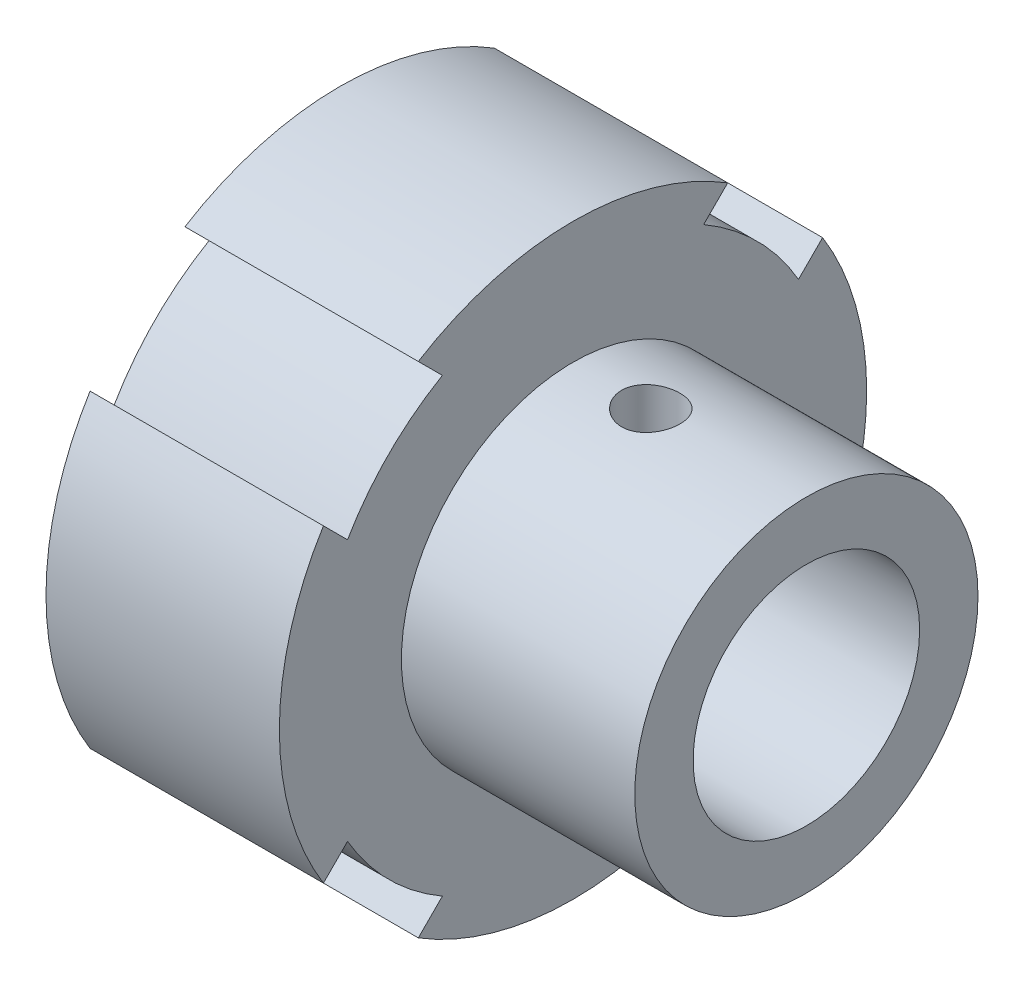
from build123d import *

# Parameters (mm, degrees)
BOSS_EXTRUDE2_DEPTH     = 10
BOSS_EXTRUDE3_DEPTH     = 2
SKETCH3_R               = 5.825
CUT_EXTRUDE1_DEPTH      = 2
BOSS_EXTRUDE4_START     = 12
SKETCH4_R               = 8.825
SKETCH4_R_2             = 5.825
BOSS_EXTRUDE4_DEPTH     = 12
CUT_EXTRUDE2_DEPTH      = 33.125068093
CUT_EXTRUDE2_DEPTH_BACK = 33.125068093
SKETCH5_R               = 1.5
CHAMFER1_SIZE           = 1


with BuildPart() as part:
    # Sketch1 → Boss-Extrude2 (new body)
    with BuildSketch(Plane(origin=(0, 0, 0), x_dir=(0, 0, -1), z_dir=(1, 0, 0))):
        with BuildLine():
            Line((-11.595322565, 6.716285775), (-12.834408967, 7.955372177))
            ThreePointArc((-12.834408967, 7.955372177), (-15.1, 0), (-12.834408967, -7.955372177))
            Line((-12.834408967, -7.955372177), (-11.595322565, -6.716285775))
            ThreePointArc((-11.595322565, -6.716285775), (-9.475230868, -9.475230868), (-6.716285775, -11.595322565))
            Line((-6.716285775, -11.595322565), (-7.955372177, -12.834408967))
            ThreePointArc((-7.955372177, -12.834408967), (0, -15.1), (7.955372177, -12.834408967))
            Line((7.955372177, -12.834408967), (6.716285775, -11.595322565))
            ThreePointArc((6.716285775, -11.595322565), (9.475230868, -9.475230868), (11.595322565, -6.716285775))
            Line((11.595322565, -6.716285775), (12.834408967, -7.955372177))
            ThreePointArc((12.834408967, -7.955372177), (14.522561334, -4.135844811), (15.1, 0))
            ThreePointArc((15.1, 0), (14.522561334, 4.135844811), (12.834408967, 7.955372177))
            Line((12.834408967, 7.955372177), (11.595322565, 6.716285775))
            ThreePointArc((11.595322565, 6.716285775), (9.475230868, 9.475230868), (6.716285775, 11.595322565))
            Line((6.716285775, 11.595322565), (7.955372177, 12.834408967))
            ThreePointArc((7.955372177, 12.834408967), (0, 15.1), (-7.955372177, 12.834408967))
            Line((-7.955372177, 12.834408967), (-6.716285775, 11.595322565))
            ThreePointArc((-6.716285775, 11.595322565), (-9.475230868, 9.475230868), (-11.595322565, 6.716285775))
        make_face()
        with BuildLine():
            Line((-11.330679795, 5.037429442), (-12.607267332, 6.31401698))
            ThreePointArc((-12.607267332, 6.31401698), (-14.1, 0), (-12.607267332, -6.31401698))
            Line((-12.607267332, -6.31401698), (-11.330679795, -5.037429442))
            ThreePointArc((-11.330679795, -5.037429442), (-8.768124087, -8.768124087), (-5.037429442, -11.330679795))
            Line((-5.037429442, -11.330679795), (-6.31401698, -12.607267332))
            ThreePointArc((-6.31401698, -12.607267332), (0, -14.1), (6.31401698, -12.607267332))
            Line((6.31401698, -12.607267332), (5.037429442, -11.330679795))
            ThreePointArc((5.037429442, -11.330679795), (8.768124087, -8.768124087), (11.330679795, -5.037429442))
            Line((11.330679795, -5.037429442), (12.607267332, -6.31401698))
            ThreePointArc((12.607267332, -6.31401698), (13.721743136, -3.244035343), (14.1, 0))
            ThreePointArc((14.1, 0), (13.721743136, 3.244035343), (12.607267332, 6.31401698))
            Line((12.607267332, 6.31401698), (11.330679795, 5.037429442))
            ThreePointArc((11.330679795, 5.037429442), (8.768124087, 8.768124087), (5.037429442, 11.330679795))
            Line((5.037429442, 11.330679795), (6.31401698, 12.607267332))
            ThreePointArc((6.31401698, 12.607267332), (0, 14.1), (-6.31401698, 12.607267332))
            Line((-6.31401698, 12.607267332), (-5.037429442, 11.330679795))
            ThreePointArc((-5.037429442, 11.330679795), (-8.768124087, 8.768124087), (-11.330679795, 5.037429442))
        make_face(mode=Mode.SUBTRACT)
    extrude(amount=BOSS_EXTRUDE2_DEPTH)

    # Sketch2 → Boss-Extrude3 (add)
    with BuildSketch(Plane(origin=(10, 0, 0), x_dir=(0, 0, -1), z_dir=(1, 0, 0))):
        with BuildLine():
            Line((-12.834408967, -7.955372177), (-11.595322565, -6.716285775))
            ThreePointArc((-11.595322565, -6.716285775), (-9.475230868, -9.475230868), (-6.716285775, -11.595322565))
            Line((-6.716285775, -11.595322565), (-7.955372177, -12.834408967))
            ThreePointArc((-7.955372177, -12.834408967), (0, -15.1), (7.955372177, -12.834408967))
            Line((7.955372177, -12.834408967), (6.716285775, -11.595322565))
            ThreePointArc((6.716285775, -11.595322565), (9.475230868, -9.475230868), (11.595322565, -6.716285775))
            Line((11.595322565, -6.716285775), (12.834408967, -7.955372177))
            ThreePointArc((12.834408967, -7.955372177), (15.1, 0), (12.834408967, 7.955372177))
            Line((12.834408967, 7.955372177), (11.595322565, 6.716285775))
            ThreePointArc((11.595322565, 6.716285775), (9.475230868, 9.475230868), (6.716285775, 11.595322565))
            Line((6.716285775, 11.595322565), (7.955372177, 12.834408967))
            ThreePointArc((7.955372177, 12.834408967), (0, 15.1), (-7.955372177, 12.834408967))
            Line((-7.955372177, 12.834408967), (-6.716285775, 11.595322565))
            ThreePointArc((-6.716285775, 11.595322565), (-9.475230868, 9.475230868), (-11.595322565, 6.716285775))
            Line((-11.595322565, 6.716285775), (-12.834408967, 7.955372177))
            ThreePointArc((-12.834408967, 7.955372177), (-15.1, 0), (-12.834408967, -7.955372177))
        make_face()
    extrude(amount=BOSS_EXTRUDE3_DEPTH)

    # Sketch3 → Cut-Extrude1 (cut)
    with BuildSketch(Plane(origin=(12, 0, 0), x_dir=(0, 0, -1), z_dir=(1, 0, 0))):
        Circle(SKETCH3_R)
    extrude(amount=-CUT_EXTRUDE1_DEPTH, mode=Mode.SUBTRACT)

    # Sketch4 → Boss-Extrude4 (add)
    with BuildSketch(Plane(origin=(12, 0, 0), x_dir=(0, 0, -1), z_dir=(1, 0, 0)).offset(BOSS_EXTRUDE4_START)):
        Circle(SKETCH4_R)
        Circle(SKETCH4_R_2, mode=Mode.SUBTRACT)
    extrude(amount=-BOSS_EXTRUDE4_DEPTH)

    # Sketch5 → Cut-Extrude2 (cut, two sides: drawn at the far end of the back side and taken through both)
    with BuildSketch(Plane(origin=(0, 0, 0), x_dir=(1, 0, 0), z_dir=(0, 1, 0)).offset(-CUT_EXTRUDE2_DEPTH_BACK)):
        with Locations(Location((16, 0, 0), (0, 0, 270))):
            Circle(SKETCH5_R)
    extrude(amount=CUT_EXTRUDE2_DEPTH + CUT_EXTRUDE2_DEPTH_BACK, mode=Mode.SUBTRACT)

    # Chamfer1
    chamfer1_edges = [part.edges().sort_by_distance(p)[0] for p in [
        (10, 0, 5.825),
    ]]
    chamfer(chamfer1_edges, length=CHAMFER1_SIZE)


solid = part.part
